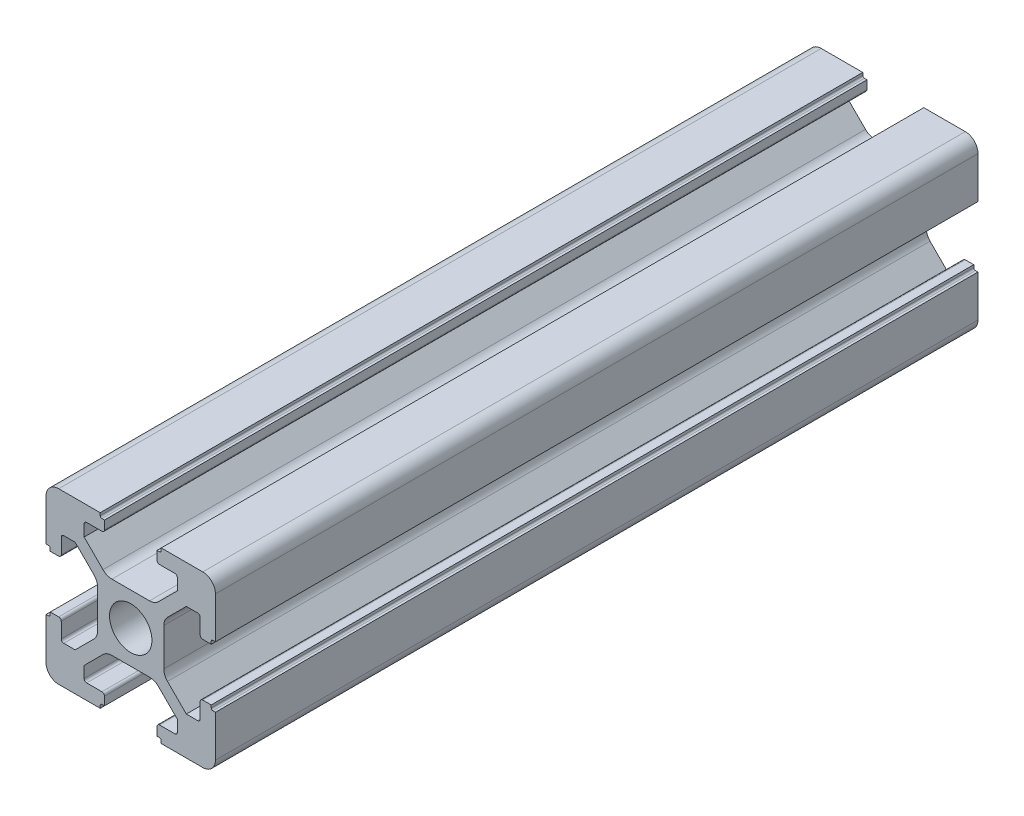
from build123d import *

# Parameters (mm, degrees)
SKETCH_1_R      = 2.5
EXTRUDE_1_DEPTH = 90


with BuildPart() as part:
    # 草图1 → 凸台-拉伸1 (new body)
    with BuildSketch(Plane.XY):
        with BuildLine():
            Line((4.215995631, 3.244230202), (6.436655803, 5.464890373))
            Line((6.436655803, 5.464890373), (7.776655803, 5.464890373))
            ThreePointArc((7.776655803, 5.464890373), (7.988787838, 5.377022408), (8.076655803, 5.164890373))
            Line((8.076655803, 5.164890373), (8.076655803, 3.364890373))
            ThreePointArc((8.076655803, 3.364890373), (8.164523769, 3.152758339), (8.376655803, 3.064890373))
            Line((8.376655803, 3.064890373), (9.376655803, 3.064890373))
            Line((9.376655803, 3.064890373), (9.376655803, 3.364890373))
            ThreePointArc((9.376655803, 3.364890373), (9.435234447, 3.50631173), (9.576655803, 3.564890373))
            Line((9.576655803, 3.564890373), (9.876655803, 3.564890373))
            Line((9.876655803, 3.564890373), (9.876655803, 8.464890373))
            ThreePointArc((9.876655803, 8.464890373), (9.437315975, 9.525550545), (8.376655803, 9.964890373))
            Line((8.376655803, 9.964890373), (3.476655803, 9.964890373))
            Line((3.476655803, 9.964890373), (3.476655803, 9.664890373))
            ThreePointArc((3.476655803, 9.664890373), (3.418077159, 9.523469017), (3.276655803, 9.464890373))
            Line((3.276655803, 9.464890373), (2.976655803, 9.464890373))
            Line((2.976655803, 9.464890373), (2.976655803, 8.464890373))
            ThreePointArc((2.976655803, 8.464890373), (3.064523769, 8.252758339), (3.276655803, 8.164890373))
            Line((3.276655803, 8.164890373), (5.076655803, 8.164890373))
            ThreePointArc((5.076655803, 8.164890373), (5.288787838, 8.077022408), (5.376655803, 7.864890373))
            Line((5.376655803, 7.864890373), (5.376655803, 6.524890373))
            Line((5.376655803, 6.524890373), (3.155995631, 4.304230202))
            ThreePointArc((3.155995631, 4.304230202), (2.669360608, 3.979071075), (2.09533546, 3.864890373))
            Line((2.09533546, 3.864890373), (-2.342023853, 3.864890373))
            ThreePointArc((-2.342023853, 3.864890373), (-2.916049002, 3.979071075), (-3.402684025, 4.304230202))
            Line((-3.402684025, 4.304230202), (-5.623344197, 6.524890373))
            Line((-5.623344197, 6.524890373), (-5.623344197, 7.864890373))
            ThreePointArc((-5.623344197, 7.864890373), (-5.535476231, 8.077022408), (-5.323344197, 8.164890373))
            Line((-5.323344197, 8.164890373), (-3.523344197, 8.164890373))
            ThreePointArc((-3.523344197, 8.164890373), (-3.311212162, 8.252758339), (-3.223344197, 8.464890373))
            Line((-3.223344197, 8.464890373), (-3.223344197, 9.464890373))
            Line((-3.223344197, 9.464890373), (-3.523344197, 9.464890373))
            ThreePointArc((-3.523344197, 9.464890373), (-3.664765553, 9.523469017), (-3.723344197, 9.664890373))
            Line((-3.723344197, 9.664890373), (-3.723344197, 9.964890373))
            Line((-3.723344197, 9.964890373), (-8.623344197, 9.964890373))
            ThreePointArc((-8.623344197, 9.964890373), (-9.684004369, 9.525550545), (-10.123344197, 8.464890373))
            Line((-10.123344197, 8.464890373), (-10.123344197, 3.564890373))
            Line((-10.123344197, 3.564890373), (-9.823344197, 3.564890373))
            ThreePointArc((-9.823344197, 3.564890373), (-9.681922841, 3.50631173), (-9.623344197, 3.364890373))
            Line((-9.623344197, 3.364890373), (-9.623344197, 3.064890373))
            Line((-9.623344197, 3.064890373), (-8.623344197, 3.064890373))
            ThreePointArc((-8.623344197, 3.064890373), (-8.411212162, 3.152758339), (-8.323344197, 3.364890373))
            Line((-8.323344197, 3.364890373), (-8.323344197, 5.164890373))
            ThreePointArc((-8.323344197, 5.164890373), (-8.235476231, 5.377022408), (-8.023344197, 5.464890373))
            Line((-8.023344197, 5.464890373), (-6.683344197, 5.464890373))
            Line((-6.683344197, 5.464890373), (-4.462684025, 3.244230202))
            ThreePointArc((-4.462684025, 3.244230202), (-4.137524898, 2.757595178), (-4.023344197, 2.18357003))
            Line((-4.023344197, 2.18357003), (-4.023344197, -2.253789283))
            ThreePointArc((-4.023344197, -2.253789283), (-4.137524898, -2.827814432), (-4.462684025, -3.314449455))
            Line((-4.462684025, -3.314449455), (-6.683344197, -5.535109627))
            Line((-6.683344197, -5.535109627), (-8.023344197, -5.535109627))
            ThreePointArc((-8.023344197, -5.535109627), (-8.235476231, -5.447241661), (-8.323344197, -5.235109627))
            Line((-8.323344197, -5.235109627), (-8.323344197, -3.435109627))
            ThreePointArc((-8.323344197, -3.435109627), (-8.411212162, -3.222977592), (-8.623344197, -3.135109627))
            Line((-8.623344197, -3.135109627), (-9.623344197, -3.135109627))
            Line((-9.623344197, -3.135109627), (-9.623344197, -3.435109627))
            ThreePointArc((-9.623344197, -3.435109627), (-9.681922841, -3.576530983), (-9.823344197, -3.635109627))
            Line((-9.823344197, -3.635109627), (-10.123344197, -3.635109627))
            Line((-10.123344197, -3.635109627), (-10.123344197, -8.535109627))
            ThreePointArc((-10.123344197, -8.535109627), (-9.684004369, -9.595769798), (-8.623344197, -10.035109627))
            Line((-8.623344197, -10.035109627), (-3.723344197, -10.035109627))
            Line((-3.723344197, -10.035109627), (-3.723344197, -9.735109627))
            ThreePointArc((-3.723344197, -9.735109627), (-3.664765553, -9.59368827), (-3.523344197, -9.535109627))
            Line((-3.523344197, -9.535109627), (-3.223344197, -9.535109627))
            Line((-3.223344197, -9.535109627), (-3.223344197, -8.535109627))
            ThreePointArc((-3.223344197, -8.535109627), (-3.311212162, -8.322977592), (-3.523344197, -8.235109627))
            Line((-3.523344197, -8.235109627), (-5.323344197, -8.235109627))
            ThreePointArc((-5.323344197, -8.235109627), (-5.535476231, -8.147241661), (-5.623344197, -7.935109627))
            Line((-5.623344197, -7.935109627), (-5.623344197, -6.595109627))
            Line((-5.623344197, -6.595109627), (-3.402684025, -4.374449455))
            ThreePointArc((-3.402684025, -4.374449455), (-2.916049002, -4.049290328), (-2.342023853, -3.935109627))
            Line((-2.342023853, -3.935109627), (2.09533546, -3.935109627))
            ThreePointArc((2.09533546, -3.935109627), (2.669360608, -4.049290328), (3.155995631, -4.374449455))
            Line((3.155995631, -4.374449455), (5.376655803, -6.595109627))
            Line((5.376655803, -6.595109627), (5.376655803, -7.935109627))
            ThreePointArc((5.376655803, -7.935109627), (5.288787838, -8.147241661), (5.076655803, -8.235109627))
            Line((5.076655803, -8.235109627), (3.276655803, -8.235109627))
            ThreePointArc((3.276655803, -8.235109627), (3.064523769, -8.322977592), (2.976655803, -8.535109627))
            Line((2.976655803, -8.535109627), (2.976655803, -9.535109627))
            Line((2.976655803, -9.535109627), (3.276655803, -9.535109627))
            ThreePointArc((3.276655803, -9.535109627), (3.418077159, -9.59368827), (3.476655803, -9.735109627))
            Line((3.476655803, -9.735109627), (3.476655803, -10.035109627))
            Line((3.476655803, -10.035109627), (8.376655803, -10.035109627))
            ThreePointArc((8.376655803, -10.035109627), (9.437315975, -9.595769798), (9.876655803, -8.535109627))
            Line((9.876655803, -8.535109627), (9.876655803, -3.635109627))
            Line((9.876655803, -3.635109627), (9.576655803, -3.635109627))
            ThreePointArc((9.576655803, -3.635109627), (9.435234447, -3.576530983), (9.376655803, -3.435109627))
            Line((9.376655803, -3.435109627), (9.376655803, -3.135109627))
            Line((9.376655803, -3.135109627), (8.376655803, -3.135109627))
            ThreePointArc((8.376655803, -3.135109627), (8.164523769, -3.222977592), (8.076655803, -3.435109627))
            Line((8.076655803, -3.435109627), (8.076655803, -5.235109627))
            ThreePointArc((8.076655803, -5.235109627), (7.988787838, -5.447241661), (7.776655803, -5.535109627))
            Line((7.776655803, -5.535109627), (6.436655803, -5.535109627))
            Line((6.436655803, -5.535109627), (4.215995631, -3.314449455))
            ThreePointArc((4.215995631, -3.314449455), (3.890836504, -2.827814432), (3.776655803, -2.253789283))
            Line((3.776655803, -2.253789283), (3.776655803, 2.18357003))
            ThreePointArc((3.776655803, 2.18357003), (3.890836504, 2.757595178), (4.215995631, 3.244230202))
        make_face()
        with Locations(Location((-0.123344197, -0.035109627, 0), (0, 0, 180))):
            Circle(SKETCH_1_R, mode=Mode.SUBTRACT)
    extrude(amount=EXTRUDE_1_DEPTH)


solid = part.part
